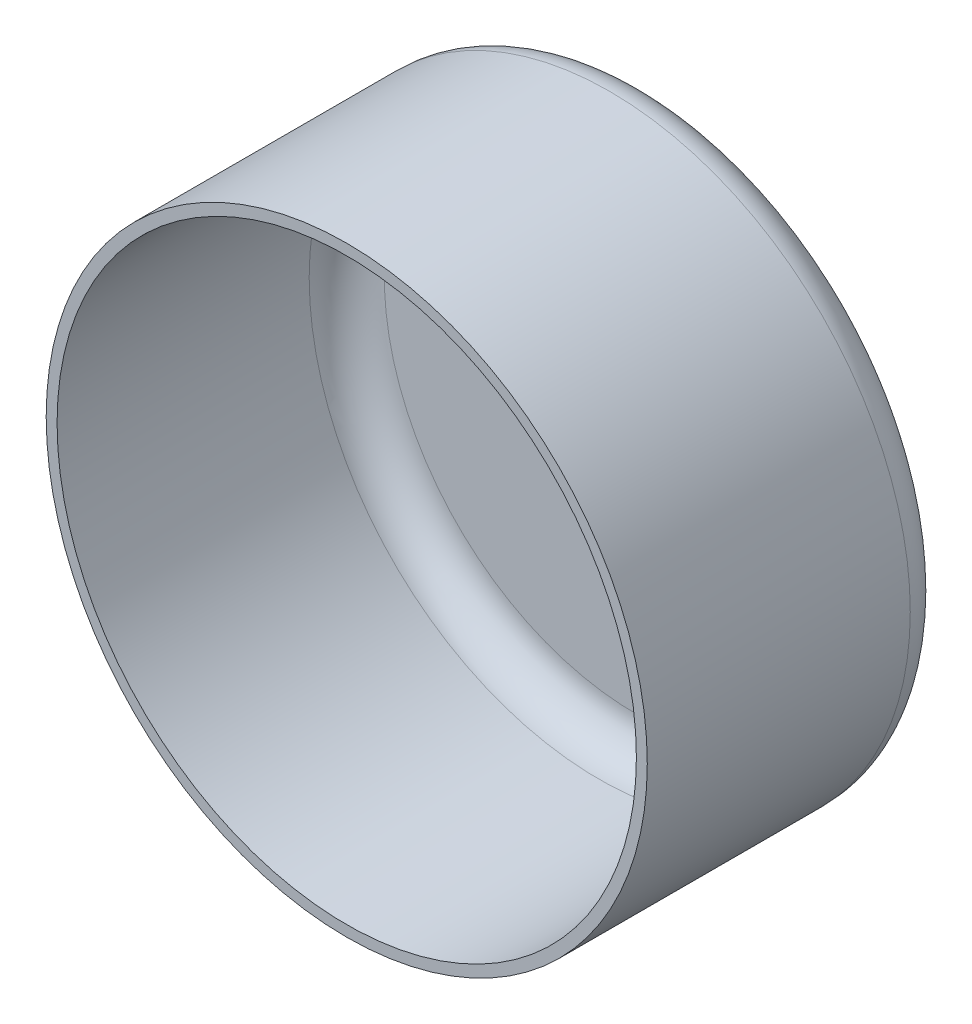
from build123d import *

# Parameters (mm, degrees)
SKETCH1_R           = 40
BOSS_EXTRUDE1_DEPTH = 40
SHELL1_T            = -1.45
FILLET1_R           = 5


with BuildPart() as part:
    # Sketch1 → Boss-Extrude1 (new body)
    with BuildSketch(Plane.XY):
        Circle(SKETCH1_R)
    extrude(amount=BOSS_EXTRUDE1_DEPTH)

    # Shell1
    shell1_openings = [part.faces().sort_by_distance(p)[0] for p in [
        (0, 0, 40),
    ]]
    offset(amount=SHELL1_T, openings=shell1_openings, kind=Kind.INTERSECTION)

    # Fillet1
    fillet1_edges = [part.edges().sort_by_distance(p)[0] for p in [
        (-40, 0, 0),
        (-38.55, 0, 1.45),
    ]]
    fillet(fillet1_edges, radius=FILLET1_R)


solid = part.part
